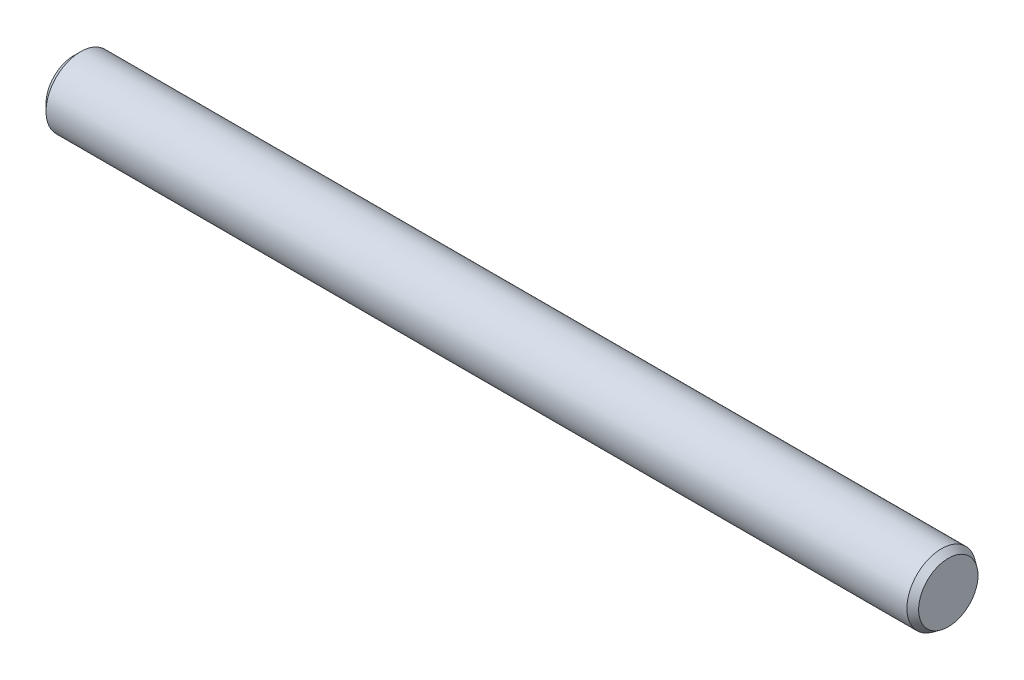
from build123d import *

# Parameters (mm, degrees)
ESQUISSE2_R        = 1.5
BOSS_EXTRU_1_DEPTH = 38
CHANFREIN4_SIZE    = 0.3
CHANFREIN4_SIZE2   = 0.210062261
CHANFREIN5_SIZE    = 0.3


with BuildPart() as part:
    # Esquisse2 → Boss.-Extru.1 (new body)
    with BuildSketch(Plane(origin=(12.8, 0, 0), x_dir=(0, 0, -1), z_dir=(1, 0, 0))):
        with Locations((59.336151833, -39.190660447)):
            Circle(ESQUISSE2_R)
    extrude(amount=-BOSS_EXTRU_1_DEPTH)

    # Chanfrein4
    chanfrein4_edges = [part.edges().sort_by_distance(p)[0] for p in [
        (12.8, -39.190660447, -57.836151833),
    ]]
    chanfrein4_side = [part.faces().sort_by_distance(p)[0] for p in [
        (-6.2, -39.190660447, -57.836151833),
    ]]
    chamfer(chanfrein4_edges, length=CHANFREIN4_SIZE, length2=CHANFREIN4_SIZE2, reference=chanfrein4_side[0])

    # Chanfrein5
    chanfrein5_edges = [part.edges().sort_by_distance(p)[0] for p in [
        (-25.2, -39.190660447, -57.836151833),
    ]]
    chamfer(chanfrein5_edges, length=CHANFREIN5_SIZE)


solid = part.part
